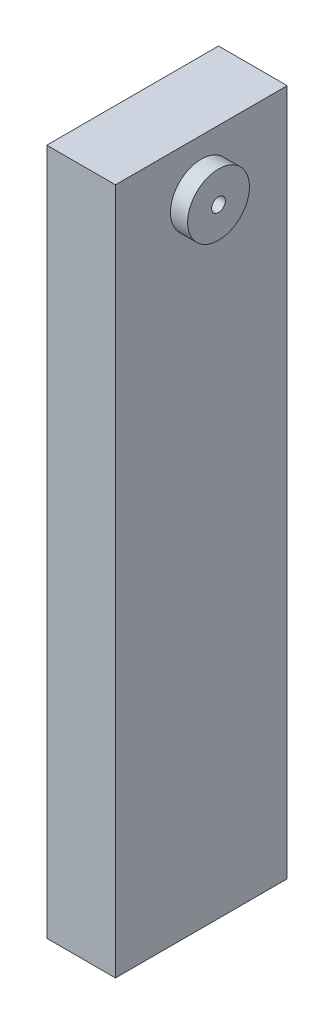
from build123d import *

# Parameters (mm, degrees)
SKETCH1_W           = 100
SKETCH1_H           = 250
BOSS_EXTRUDE1_DEPTH = 1000
SKETCH2_R           = 45
BOSS_EXTRUDE2_DEPTH = 25
SKETCH3_R           = 10
CUT_EXTRUDE1_DEPTH  = 25


with BuildPart() as part:
    # Sketch1 → Boss-Extrude1 (new body)
    with BuildSketch(Plane(origin=(0, 0, 0), x_dir=(1, 0, 0), z_dir=(0, 1, 0))):
        Rectangle(SKETCH1_W, SKETCH1_H)
    extrude(amount=BOSS_EXTRUDE1_DEPTH)

    # Sketch2 → Boss-Extrude2 (add)
    with BuildSketch(Plane(origin=(50, 0, 0), x_dir=(0, 0, -1), z_dir=(1, 0, 0))):
        with Locations(Location((0, 925, 0), (0, 0, 180))):
            Circle(SKETCH2_R)
    extrude(amount=BOSS_EXTRUDE2_DEPTH)

    # Sketch3 → Cut-Extrude1 (cut)
    with BuildSketch(Plane(origin=(75, 0, 0), x_dir=(0, 0, -1), z_dir=(1, 0, 0))):
        with Locations((0, 925)):
            Circle(SKETCH3_R)
    extrude(amount=-CUT_EXTRUDE1_DEPTH, mode=Mode.SUBTRACT)


solid = part.part
